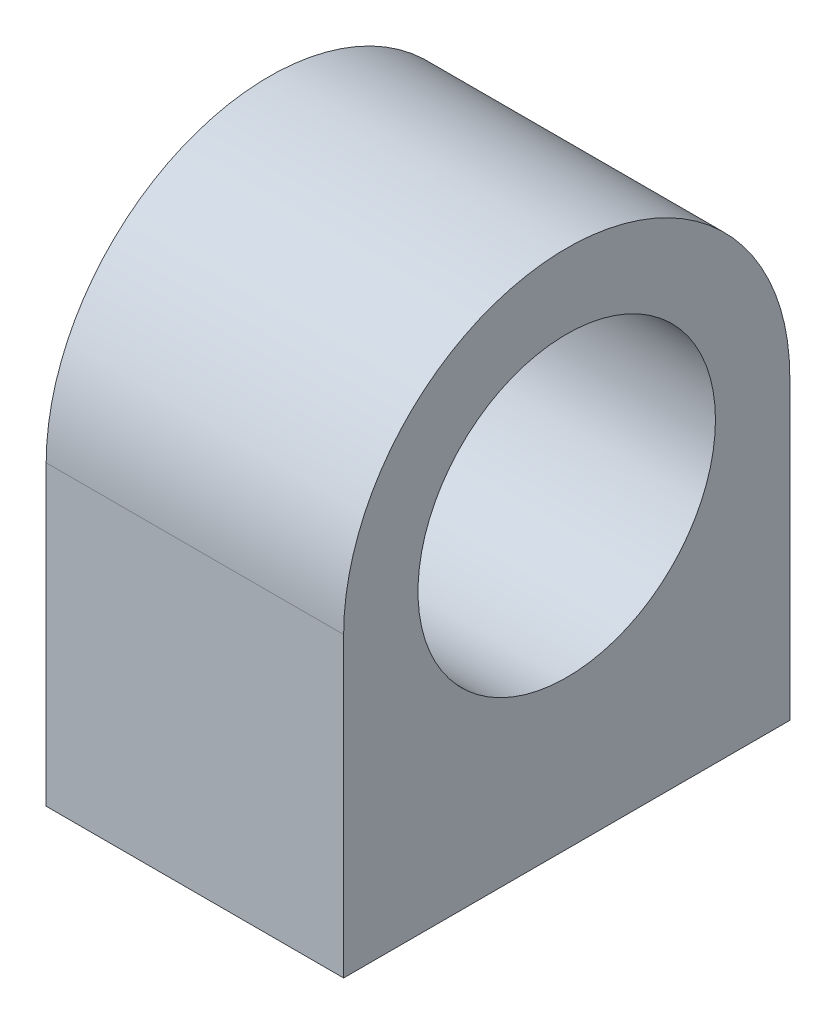
from build123d import *

# Parameters (mm, degrees)
SKETCH1_R           = 0.5
BOSS_EXTRUDE1_DEPTH = 0.5
HOLE1_D             = 0.25
HOLE1_DEPTH         = 0.5


with BuildPart() as part:
    # Sketch1 → Boss-Extrude1 (new, symmetric)
    with BuildSketch(Plane(origin=(0, 0, 0), x_dir=(0, 0, -1), z_dir=(1, 0, 0))):
        with BuildLine():
            Line((-0.75, 1), (-0.75, 0))
            Line((-0.75, 0), (0.75, 0))
            Line((0.75, 0), (0.75, 1))
            ThreePointArc((0.75, 1), (0, 1.75), (-0.75, 1))
        make_face()
        with Locations((0, 1)):
            Circle(SKETCH1_R, mode=Mode.SUBTRACT)
    extrude(amount=BOSS_EXTRUDE1_DEPTH, both=True)

    # Hole1
    with Locations(Plane(origin=(0, 0, 0), x_dir=(-1, 0, 0), z_dir=(0, -1, 0))):
        with Locations((0, -0.5), (0, 0.5)):
            Hole(HOLE1_D / 2, depth=HOLE1_DEPTH)


solid = part.part
